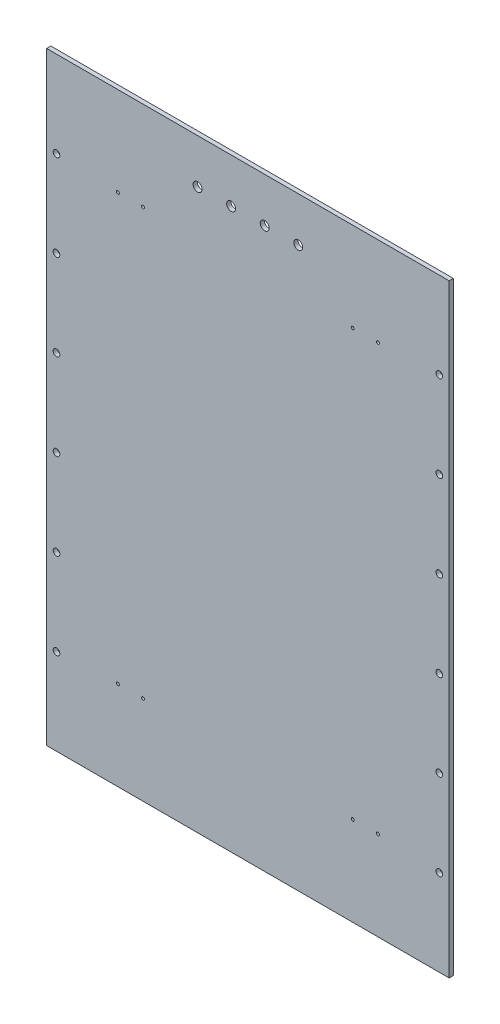
from build123d import *

# Parameters (mm, degrees)
SKETCH1_W               = 609.6
SKETCH1_H               = 914.4
BOSS_EXTRUDE1_DEPTH     = 3.175
F_8_CLEARANCE_HOLE1_D   = 4.4958
CUT_EXTRUDE1_DEPTH      = 550.522704263
CUT_EXTRUDE1_DEPTH_BACK = 550.522704263
SKETCH4_R               = 6.74624
F_3_8_CLEARANCE_HOLE1_D = 10.0838


with BuildPart() as part:
    # Sketch1 → Boss-Extrude1 (new, symmetric)
    with BuildSketch(Plane.XY):
        Rectangle(SKETCH1_W, SKETCH1_H)
    extrude(amount=BOSS_EXTRUDE1_DEPTH, both=True)

    # #8 Clearance Hole1 (through all)
    with Locations(Plane.XY.offset(3.175)):
        with Locations((-196.85, -322.2625), (-158.75, -322.2625), (196.85, -322.2625), (158.75, -322.2625), (158.75, 322.2625), (196.85, 322.2625), (-158.75, 322.2625), (-196.85, 322.2625)):
            Hole(F_8_CLEARANCE_HOLE1_D / 2)

    # Sketch4 → Cut-Extrude1 (cut, two sides: drawn at the far end of the back side and taken through both)
    with BuildSketch(Plane.XY.offset(3.175).offset(-CUT_EXTRUDE1_DEPTH_BACK)):
        with Locations((76.2, 389.892639343)):
            Circle(SKETCH4_R)
        with Locations((-25.4, 389.892639343)):
            Circle(SKETCH4_R)
        with Locations((25.4, 389.892639343)):
            Circle(SKETCH4_R)
        with Locations((-76.2, 389.892639343)):
            Circle(SKETCH4_R)
    extrude(amount=CUT_EXTRUDE1_DEPTH + CUT_EXTRUDE1_DEPTH_BACK, mode=Mode.SUBTRACT)

    # 3/8 Clearance Hole1 (through all)
    with Locations(Plane.XY.offset(3.175)):
        with Locations((-289.8775, -326.571428571), (-289.8775, -195.942857215), (-289.8775, -65.314285859), (-289.8775, 65.314285497), (-289.8775, 195.942856853), (-289.8775, 326.571428209), (289.8775, 326.571428209), (289.8775, 195.942856853), (289.8775, 65.314285497), (289.8775, -65.314285859), (289.8775, -195.942857215), (289.8775, -326.571428571)):
            Hole(F_3_8_CLEARANCE_HOLE1_D / 2)


solid = part.part
